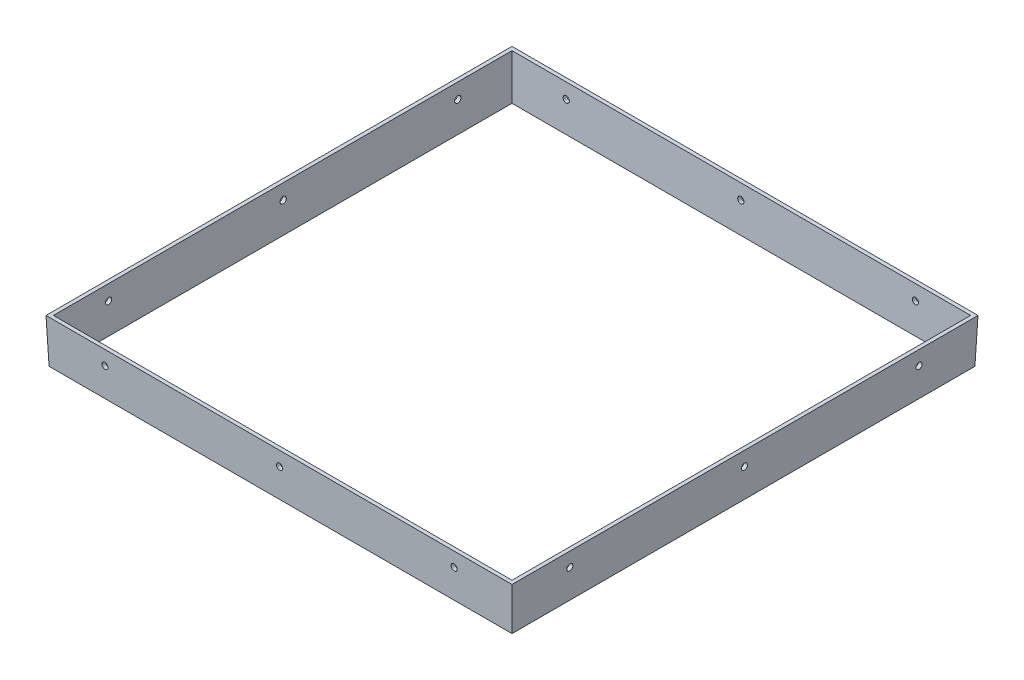
from build123d import *

# Parameters (mm, degrees)
SKETCH2_W           = 251.86
SKETCH2_H           = 251.86
BOSS_EXTRUDE1_DEPTH = 24
BOSS_EXTRUDE1_DRAFT = -2
SHELL1_T            = -2
CUT_EXTRUDE1_START  = -10
SKETCH3_R           = 1.7
CUT_EXTRUDE1_DEPTH  = 294.998422143
SKETCH4_R           = 1.7
CUT_EXTRUDE2_DEPTH  = 10


with BuildPart() as part:
    # Sketch2 → Boss-Extrude1 (with draft: the straight prism first)
    with BuildSketch(Plane(origin=(0, 0, 0), x_dir=(1, 0, 0), z_dir=(0, 1, 0))):
        Rectangle(SKETCH2_W, SKETCH2_H)
    extrude(amount=BOSS_EXTRUDE1_DEPTH)
    # Boss-Extrude1: the draft: its side faces are tilted about the plane it starts from
    boss_extrude1_sides = [part.faces().sort_by_distance(p)[0] for p in [
        (0, 12, 125.93),
        (125.93, 12, 0),
        (0, 12, -125.93),
        (-125.93, 12, 0),
    ]]
    draft(boss_extrude1_sides, Plane(origin=(0, 0, 0), x_dir=(1, 0, 0), z_dir=(0, 1, 0)), BOSS_EXTRUDE1_DRAFT)

    # Shell1
    shell1_openings = [part.faces().sort_by_distance(p)[0] for p in [
        (0, 24, 0),
        (0, 0, 0),
    ]]
    offset(amount=SHELL1_T, openings=shell1_openings, kind=Kind.INTERSECTION)

    # Sketch3 → Cut-Extrude1 (cut)
    with BuildSketch(Plane(origin=(-125.776620425, -4.392216369, 0), x_dir=(0, 0, 1), z_dir=(-0.9993908270190958, -0.03489949670250105, 0)).offset(CUT_EXTRUDE1_START)):
        with Locations(Location((-95, 20.409522683, 0), (0, 0, 270))):
            Circle(SKETCH3_R)
        with Locations(Location((0, 20.409522683, 0), (0, 0, 270))):
            Circle(SKETCH3_R)
        with Locations(Location((95, 20.409522683, 0), (0, 0, 270))):
            Circle(SKETCH3_R)
    cut_extrude1 = extrude(amount=CUT_EXTRUDE1_DEPTH, mode=Mode.SUBTRACT)

    # Mirror1: Cut-Extrude1 across plane
    add(cut_extrude1.mirror(Plane(origin=(0, 0, 0), x_dir=(0, 0, 1), z_dir=(1, 0, 0))), mode=Mode.SUBTRACT)

    # Sketch4 → Cut-Extrude2 (cut)
    with BuildSketch(Plane(origin=(0, -4.392216369, -125.776620425), x_dir=(-1, 0, 0), z_dir=(0, -0.03489949670250105, -0.9993908270190958))):
        with Locations(Location((-95, 20.409522683, 0), (0, 0, 90))):
            Circle(SKETCH4_R)
        with Locations(Location((0, 20.409522683, 0), (0, 0, 90))):
            Circle(SKETCH4_R)
        with Locations(Location((95, 20.409522683, 0), (0, 0, 90))):
            Circle(SKETCH4_R)
    cut_extrude2 = extrude(amount=-CUT_EXTRUDE2_DEPTH, mode=Mode.SUBTRACT)

    # Mirror2: Cut-Extrude2 across plane
    add(cut_extrude2.mirror(Plane.XY), mode=Mode.SUBTRACT)


solid = part.part
